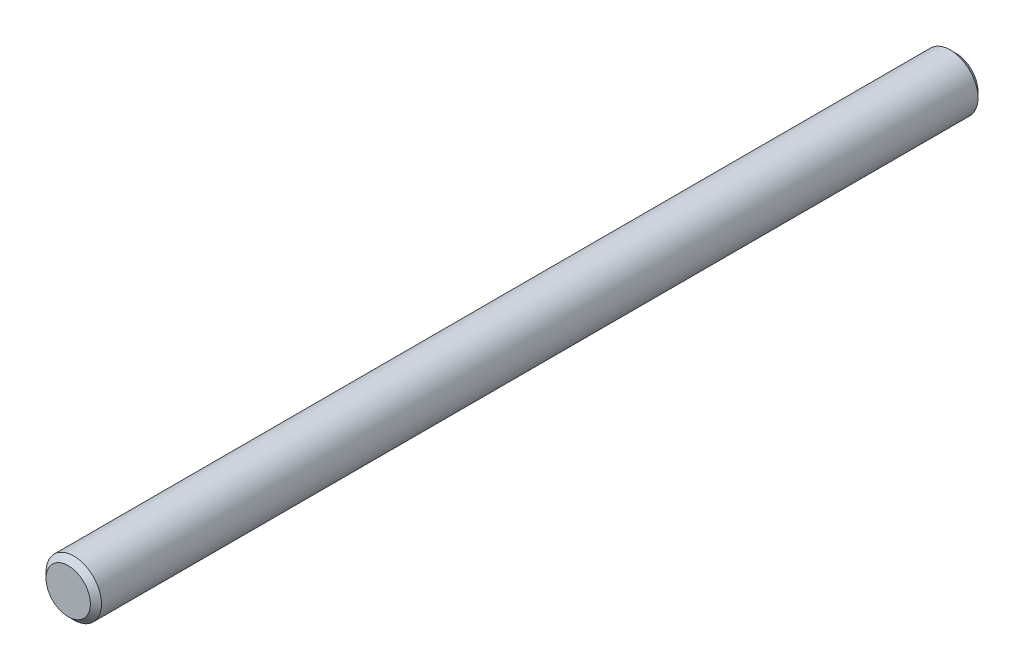
from build123d import *

# Parameters (mm, degrees)
SKETCH1_R      = 3.175
EXTRUDE1_DEPTH = 50.8
CHAMFER1_SIZE  = 0.635


with BuildPart() as part:
    # Sketch1 → Extrude1 (new, symmetric)
    with BuildSketch(Plane.XY):
        Circle(SKETCH1_R)
    extrude(amount=EXTRUDE1_DEPTH, both=True)

    # Chamfer1
    chamfer1_edges = [part.edges().sort_by_distance(p)[0] for p in [
        (-3.175, 0, -50.8),
        (-3.175, 0, 50.8),
    ]]
    chamfer(chamfer1_edges, length=CHAMFER1_SIZE)


solid = part.part
